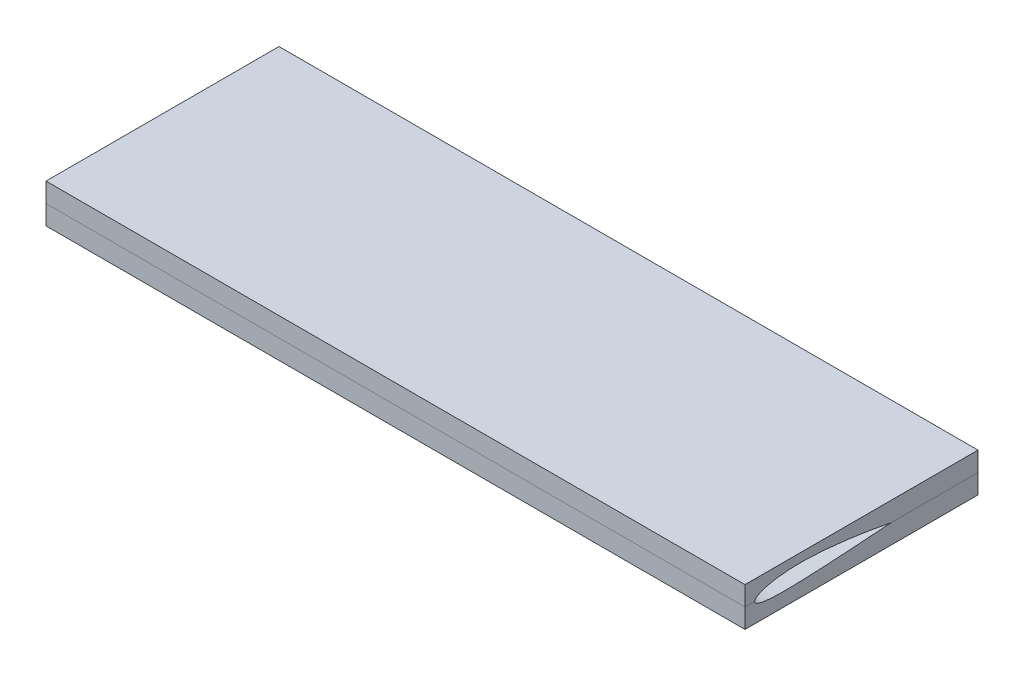
from build123d import *

# Parameters (mm, degrees)
SKETCH1_W           = 609.6
SKETCH1_H           = 101.6
BOSS_EXTRUDE1_DEPTH = 914.4


with BuildPart() as part:
    # Sketch1 → Boss-Extrude1 (new, symmetric)
    with BuildSketch(Plane(origin=(0, 0, 0), x_dir=(0, 0, -1), z_dir=(1, 0, 0))):
        with Locations((279.4, 0)):
            Rectangle(SKETCH1_W, SKETCH1_H)
        with BuildLine():
            Line((355.599995778, 0.088899993), (355.600004222, -0.088899993))
            add(Edge.make_bspline(
                [(355.599995778, 0.088899993), (353.719919628, 0.484485581), (349.962916086, 1.274994229), (344.321357204, 2.408274034), (338.683668583, 3.512244286), (333.050236726, 4.587785987), (327.422693692, 5.639432655), (321.802334741, 6.668857961), (314.329135268, 8.011385096), (303.170369871, 9.958422722), (290.194287361, 12.107358077), (277.289771757, 14.118748691), (266.32724231, 15.739151064), (251.90729176, 17.753444463), (237.620805882, 19.578238431), (223.484571155, 21.221203013), (213.079958676, 22.35244674), (202.818953541, 23.390777248), (192.711844061, 24.335220131), (182.768771906, 25.183158052), (172.999706974, 25.930638246), (161.8755037, 26.675974905), (149.491704209, 27.346118936), (135.950809215, 27.840399909), (122.906863741, 28.059891495), (110.38955742, 28.000634334), (99.672207938, 27.700985353), (90.667971982, 27.262292799), (83.279992978, 26.775857592), (76.166179431, 26.181085385), (69.333698868, 25.483651689), (62.78942488, 24.68967134), (56.539916188, 23.805557546), (50.591433903, 22.837910647), (44.949952532, 21.793499475), (39.621112912, 20.679278548), (35.38459791, 19.684279107), (31.410842402, 18.666344518), (28.39403653, 17.828103782), (25.494164793, 16.950750808), (23.438681715, 16.293491786), (21.46678011, 15.626915769), (19.578952701, 14.951912739), (17.775664606, 14.269365904), (16.057362792, 13.580122722), (14.424466236, 12.885010511), (12.877370576, 12.184822001), (11.41645423, 11.480293146), (10.042056179, 10.772140432), (8.754511409, 10.060984054), (7.554107415, 9.347425864), (6.441119863, 8.631976574), (5.415793041, 7.915079727), (4.478345909, 7.197107261), (3.628976492, 6.478343988), (2.867864561, 5.758991675), (2.195190165, 5.03915146), (1.611133495, 4.318845026), (1.115921313, 3.59800481), (0.709825307, 2.87650933), (0.393271271, 2.15423771), (0.166504254, 1.431146413), (0.030737644, 0.707331331), (-0.01510981, 0.002329326), (0.030103712, -0.683215048), (0.166757283, -1.346959587), (0.393300202, -2.005722915), (0.709982051, -2.657303726), (1.116181328, -3.299762384), (1.611583629, -3.931365111), (2.19588676, -4.550541061), (2.868853595, -5.155873444), (3.630284522, -5.746072074), (4.479990283, -6.319989017), (5.41777842, -6.876617983), (6.443440476, -7.415118179), (7.556746328, -7.934809954), (8.757450602, -8.435162267), (10.04527274, -8.915818462), (11.419918332, -9.376544391), (12.881056499, -9.817279011), (14.428342684, -10.238048563), (16.061401534, -10.639008832), (17.779837371, -11.020391175), (19.583230149, -11.382503507), (21.471138203, -11.72569046), (23.443096697, -12.050327435), (25.498615858, -12.356818022), (27.637186796, -12.645541454), (29.858278076, -12.916863624), (32.161337168, -13.17112178), (35.392871871, -13.492971246), (39.633515491, -13.851127367), (44.961680314, -14.209933523), (50.602431788, -14.504901453), (56.550155093, -14.736048774), (62.798888687, -14.903214972), (69.342369229, -15.006422563), (76.174024321, -15.046294155), (83.286967172, -15.024333631), (90.674025931, -14.943132189), (98.327760574, -14.806320398), (106.240488655, -14.618358339), (114.404261409, -14.384158225), (122.810873499, -14.108588395), (131.451881899, -13.795890053), (140.318604404, -13.449239271), (149.402126747, -13.070337509), (161.921237989, -12.516505896), (174.697664724, -11.901159381), (187.718132989, -11.217108995), (197.744296345, -10.659602088), (207.929345735, -10.062346652), (220.025511725, -9.319207642), (232.279253589, -8.53057328), (244.678709307, -7.712713438), (255.449825815, -6.996932102), (264.490823064, -6.397512526), (273.609082441, -5.796208069), (282.795452689, -5.193636154), (293.872010722, -4.467502283), (303.143053311, -3.850890022), (310.58793423, -3.34310816), (316.18970464, -2.95303736), (321.801365046, -2.553083045), (327.421479554, -2.143029396), (333.048603174, -1.724268081), (338.681282888, -1.299908993), (344.318125247, -0.877582287), (349.957440029, -0.463228733), (353.719205679, -0.213672512), (355.600004222, -0.088899993)],
                knots=[0, 0, 0, 0, 0.007940543, 0.015867786, 0.023782336, 0.031683842, 0.039571466, 0.047443805, 0.055299407, 0.070952907, 0.094259966, 0.109659749, 0.124931368, 0.140060475, 0.169836167, 0.184455938, 0.198878988, 0.213091981, 0.227081364, 0.240833733, 0.254335896, 0.267574898, 0.286913018, 0.305591757, 0.323574751, 0.340828862, 0.357323531, 0.367884026, 0.378086462, 0.387923234, 0.397387015, 0.406470797, 0.41516795, 0.423472244, 0.43137777, 0.438879022, 0.445971139, 0.449362331, 0.455832514, 0.458910652, 0.461883669, 0.464751272, 0.467513247, 0.470169459, 0.472719872, 0.475164567, 0.477503762, 0.479737826, 0.481867333, 0.483893084, 0.485816152, 0.487637951, 0.489360303, 0.49098553, 0.492516542, 0.493957004, 0.495311466, 0.496585561, 0.4977862, 0.498921787, 0.500002352, 0.50103964, 0.502046987, 0.503038995, 0.503951731, 0.504878158, 0.505831393, 0.506823576, 0.507865603, 0.508967032, 0.510136107, 0.511379885, 0.512704371, 0.51411466, 0.515615093, 0.517209348, 0.518900571, 0.520691419, 0.522584144, 0.524580638, 0.526682478, 0.528890964, 0.531207133, 0.533631806, 0.536165599, 0.538808937, 0.541562081, 0.544425147, 0.547398108, 0.550480817, 0.553673027, 0.556974385, 0.563902733, 0.571261381, 0.579045037, 0.58724742, 0.595861595, 0.604880098, 0.614294871, 0.624097261, 0.634278056, 0.644827522, 0.655735355, 0.666990799, 0.678582536, 0.690498843, 0.702727789, 0.715257042, 0.728074047, 0.754520377, 0.768123571, 0.781962351, 0.796022904, 0.810291085, 0.832050541, 0.846772874, 0.861649926, 0.876666219, 0.884221743, 0.899417941, 0.914715475, 0.9300999, 0.937820202, 0.945556969, 0.953308312, 0.961072259, 0.968846879, 0.976629764, 0.984418334, 0.992209516, 1, 1, 1, 1], degree=3))
        make_face(mode=Mode.SUBTRACT)
    extrude(amount=BOSS_EXTRUDE1_DEPTH, both=True)


with BuildPart() as body_2:
    # Split1: the piece on the far side of the plane
    add(part.part)
    split(bisect_by=Plane.ZX, keep=Keep.BOTTOM)


with BuildPart() as part_1:
    add(part.part)

    # Split1
    split(bisect_by=Plane.ZX, keep=Keep.TOP)


solid = Compound([body_2.part, part_1.part])
